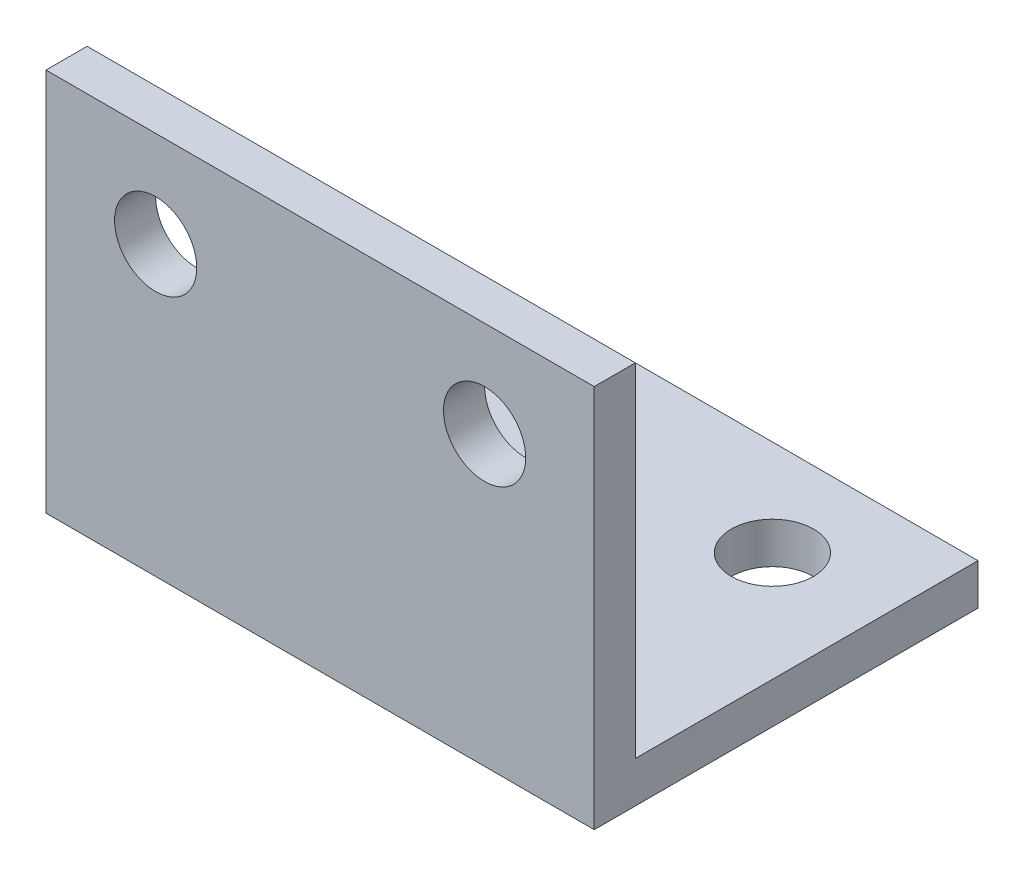
from build123d import *

# Parameters (mm, degrees)
EXTRUDE_1_DEPTH     = 20
SKETCH_2_R          = 1.5
CUT_EXTRUDE_1_DEPTH = 28.427176304
SKETCH_3_R          = 1.5
CUT_EXTRUDE_2_DEPTH = 28.427176304


with BuildPart() as part:
    # 草图1 → 凸台-拉伸1 (new body)
    with BuildSketch(Plane(origin=(0, 0, 0), x_dir=(0, 0, -1), z_dir=(1, 0, 0))):
        Polygon((0, 0), (0, 14), (1.5, 14), (1.5, 1.5), (14, 1.5), (14, 0), align=None)
    extrude(amount=EXTRUDE_1_DEPTH)

    # 草图2 → 切除-拉伸1 (cut, through all)
    with BuildSketch(Plane(origin=(0, 0, -1.5), x_dir=(-1, 0, 0), z_dir=(0, 0, -1))):
        with Locations(Location((-16, 10.5, 0), (0, 0, 90))):
            Circle(SKETCH_2_R)
        with Locations(Location((-4, 10.5, 0), (0, 0, 90))):
            Circle(SKETCH_2_R)
    extrude(amount=-CUT_EXTRUDE_1_DEPTH, mode=Mode.SUBTRACT)

    # 草图3 → 切除-拉伸2 (cut, through all)
    with BuildSketch(Plane(origin=(0, 1.5, 0), x_dir=(1, 0, 0), z_dir=(0, 1, 0))):
        with Locations(Location((4, 10.5, 0), (0, 0, 270))):
            Circle(SKETCH_3_R)
        with Locations(Location((16, 10.5, 0), (0, 0, 270))):
            Circle(SKETCH_3_R)
    extrude(amount=-CUT_EXTRUDE_2_DEPTH, mode=Mode.SUBTRACT)


solid = part.part
